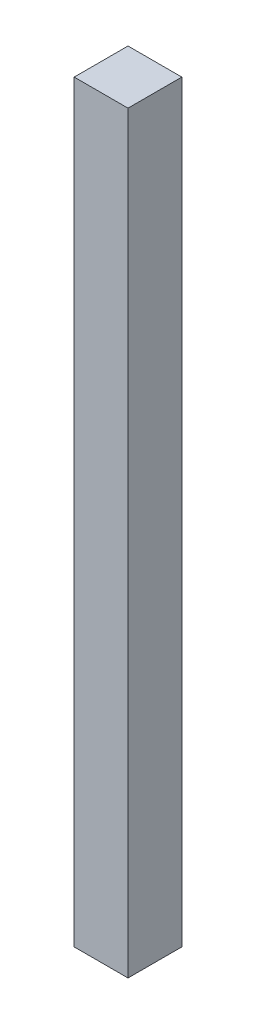
from build123d import *

# Parameters (mm, degrees)
SKETCH1_W           = 25.4
SKETCH1_H           = 25.4
BOSS_EXTRUDE1_DEPTH = 177.8


with BuildPart() as part:
    # Sketch1 → Boss-Extrude1 (new, symmetric)
    with BuildSketch(Plane(origin=(0, 0, 0), x_dir=(1, 0, 0), z_dir=(0, 1, 0))):
        Rectangle(SKETCH1_W, SKETCH1_H)
    extrude(amount=BOSS_EXTRUDE1_DEPTH, both=True)


solid = part.part
